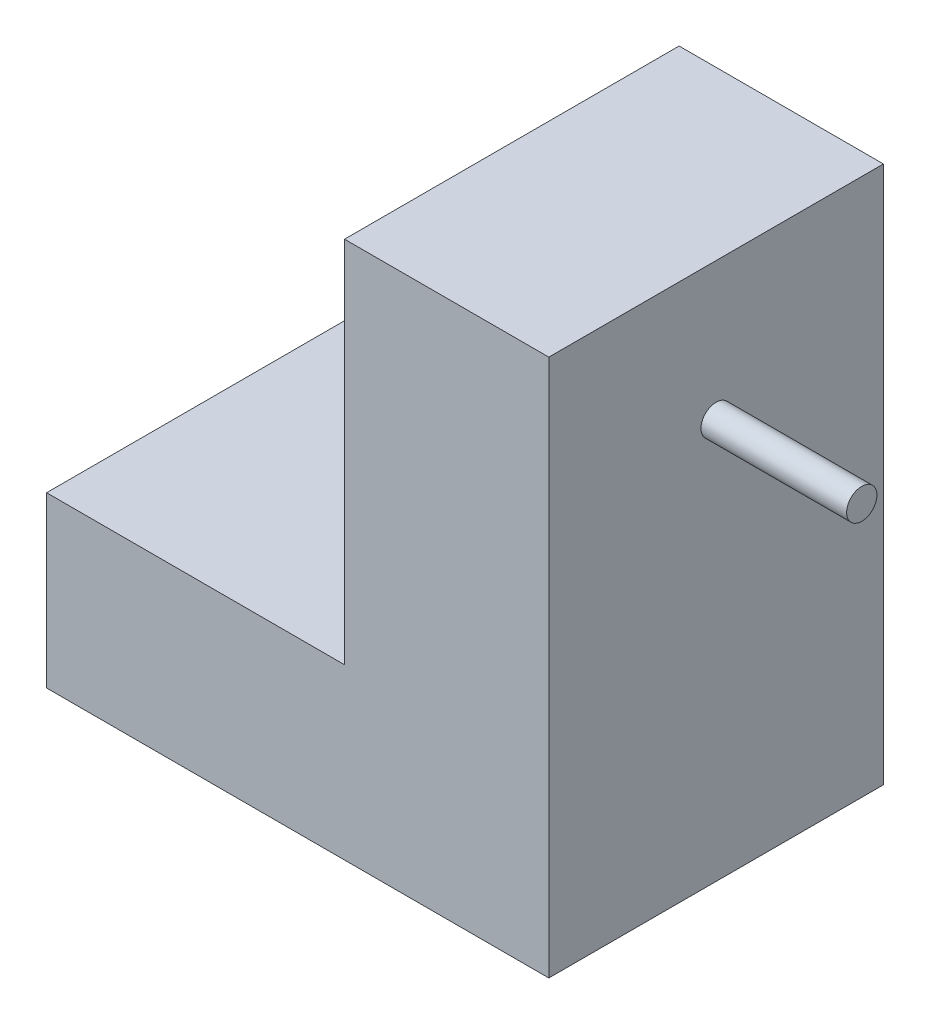
from build123d import *

# Parameters (mm, degrees)
SKETCH1_W           = 34
SKETCH1_H           = 22.65
BOSS_EXTRUDE1_DEPTH = 11.45
SKETCH2_W           = 13.83
SKETCH2_H           = 22.65
BOSS_EXTRUDE2_DEPTH = 24.95
SKETCH5_R           = 1.025
BOSS_EXTRUDE3_DEPTH = 9.86


with BuildPart() as part:
    # Sketch1 → Boss-Extrude1 (new body)
    with BuildSketch(Plane(origin=(0, 0, 0), x_dir=(1, 0, 0), z_dir=(0, 1, 0))):
        Rectangle(SKETCH1_W, SKETCH1_H)
    extrude(amount=BOSS_EXTRUDE1_DEPTH)

    # Sketch2 → Boss-Extrude2 (add)
    with BuildSketch(Plane(origin=(0, 11.45, 0), x_dir=(1, 0, 0), z_dir=(0, 1, 0))):
        with Locations((10.085, 0)):
            Rectangle(SKETCH2_W, SKETCH2_H)
    extrude(amount=BOSS_EXTRUDE2_DEPTH)

    # Sketch5 → Boss-Extrude3 (add)
    with BuildSketch(Plane(origin=(17, 0, 0), x_dir=(0, 0, -1), z_dir=(1, 0, 0))):
        with Locations(Location((0, 27.07, 0), (0, 0, 180))):
            Circle(SKETCH5_R)
    extrude(amount=BOSS_EXTRUDE3_DEPTH)


solid = part.part
